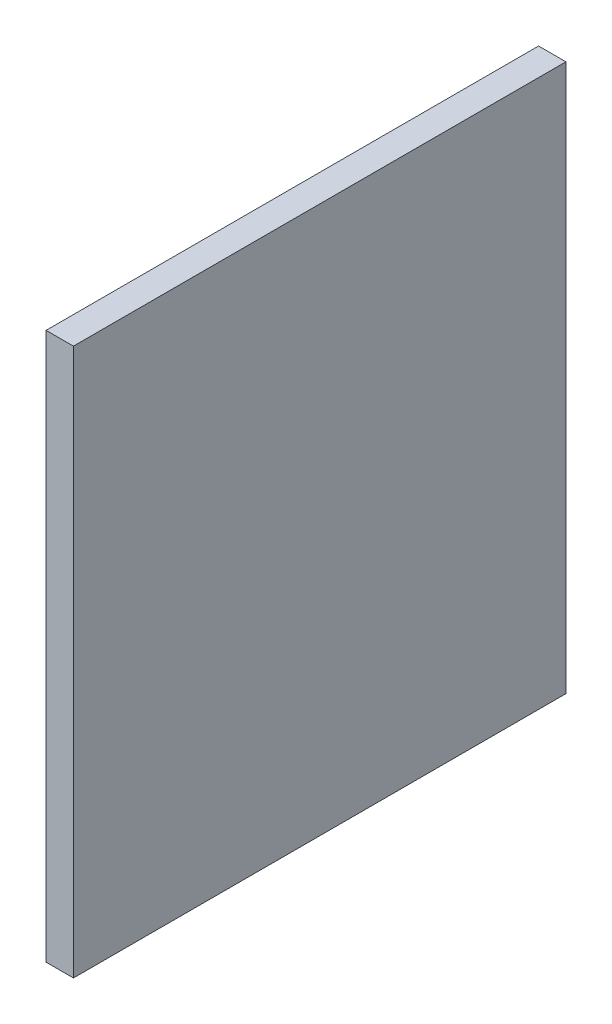
from build123d import *

# Parameters (mm, degrees)
SKETCH2_W               = 330
SKETCH2_H               = 200
BOSS_EXTRUDE1_DEPTH     = 10
SKETCH3_R               = 5
CUT_EXTRUDE1_DEPTH      = 10
MIRROR2_COPY_1_SKETCH_R = 5
MIRROR2_COPY_1_DEPTH    = 10
SKETCH4_W               = 10
SKETCH4_H               = 200
CUT_EXTRUDE2_DEPTH      = 150


with BuildPart() as part:
    # Sketch2 → Boss-Extrude1 (new body)
    with BuildSketch(Plane(origin=(0, 0, 0), x_dir=(0, 0, -1), z_dir=(1, 0, 0))):
        with Locations((165, 100)):
            Rectangle(SKETCH2_W, SKETCH2_H)
    extrude(amount=BOSS_EXTRUDE1_DEPTH)

    # Sketch3 → Cut-Extrude1 (cut)
    with BuildSketch(Plane(origin=(10, 0, 0), x_dir=(0, 0, -1), z_dir=(1, 0, 0))):
        with Locations((16, 25)):
            Circle(SKETCH3_R)
    cut_extrude1 = extrude(amount=-CUT_EXTRUDE1_DEPTH, mode=Mode.SUBTRACT)

    # Mirror1: Cut-Extrude1 across plane
    add(cut_extrude1.mirror(Plane.ZX.offset(50)), mode=Mode.SUBTRACT)

    # Mirror2: Cut-Extrude1 across plane
    add(cut_extrude1.mirror(Plane.ZX.offset(100)), mode=Mode.SUBTRACT)

    # Mirror2 copy 1 sketch → Mirror2 copy 1 (cut)
    with BuildSketch(Plane(origin=(10, 100, 0), x_dir=(0, 0, -1), z_dir=(1, 0, 0))):
        with Locations((16, 25)):
            Circle(MIRROR2_COPY_1_SKETCH_R)
    extrude(amount=-MIRROR2_COPY_1_DEPTH, mode=Mode.SUBTRACT)

    # Sketch4 → Cut-Extrude2 (cut)
    with BuildSketch(Plane.XY):
        with Locations((5, 100)):
            Rectangle(SKETCH4_W, SKETCH4_H)
    extrude(amount=-CUT_EXTRUDE2_DEPTH, mode=Mode.SUBTRACT)


solid = part.part
